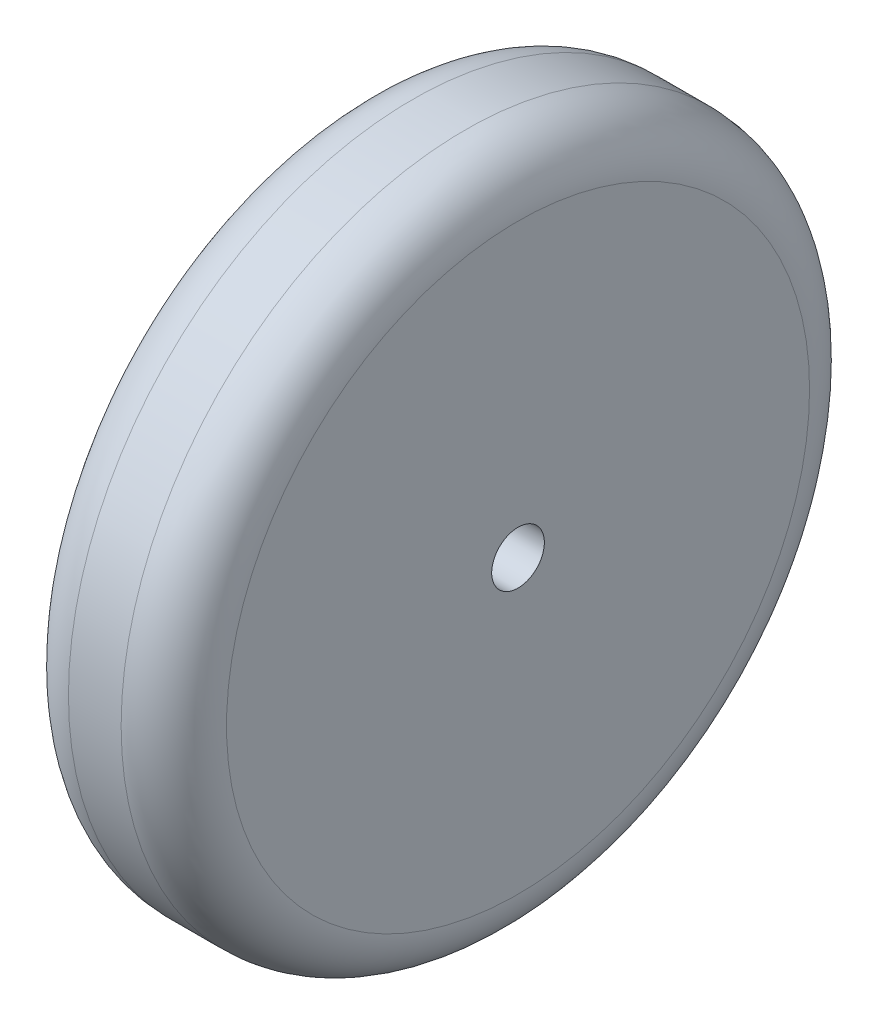
from build123d import *

# Parameters (mm, degrees)
SKETCH1_R           = 65.327652275
SKETCH1_R_2         = 5
BOSS_EXTRUDE1_DEPTH = 30
FILLET1_R           = 10


with BuildPart() as part:
    # Sketch1 → Boss-Extrude1 (new body)
    with BuildSketch(Plane(origin=(0, 0, 0), x_dir=(0, 0, -1), z_dir=(1, 0, 0))):
        Circle(SKETCH1_R)
        Circle(SKETCH1_R_2, mode=Mode.SUBTRACT)
    extrude(amount=BOSS_EXTRUDE1_DEPTH)

    # Fillet1
    fillet1_edges = [part.edges().sort_by_distance(p)[0] for p in [
        (0, 0, 65.327652275),
        (30, 0, 65.327652275),
    ]]
    fillet(fillet1_edges, radius=FILLET1_R)


solid = part.part
